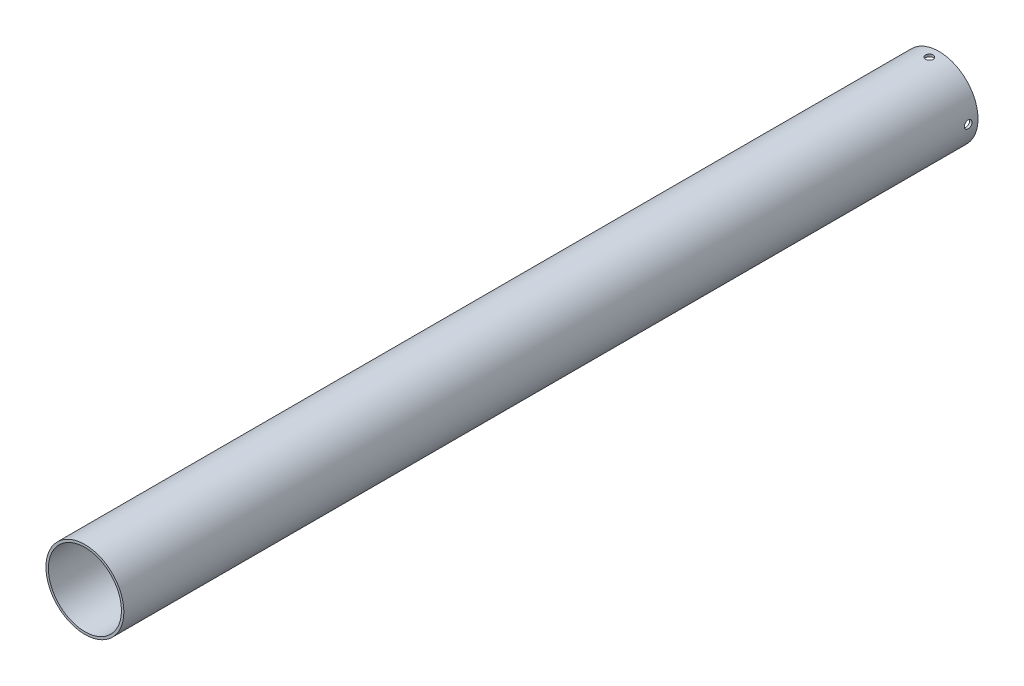
from build123d import *

# Parameters (mm, degrees)
SKETCH1_R               = 25.4
SKETCH1_R_2             = 23.8125
BOSS_EXTRUDE1_DEPTH     = 278.342506179
CUT_EXTRUDE1_DEPTH      = 281.650798584
CUT_EXTRUDE1_DEPTH_BACK = 281.650798584
SKETCH2_R               = 2.4892
CUT_EXTRUDE2_DEPTH      = 281.650798702
CUT_EXTRUDE2_DEPTH_BACK = 281.650798702
SKETCH3_R               = 2.4892


with BuildPart() as part:
    # Sketch1 → Boss-Extrude1 (new, symmetric)
    with BuildSketch(Plane.XY):
        Circle(SKETCH1_R)
        Circle(SKETCH1_R_2, mode=Mode.SUBTRACT)
    extrude(amount=BOSS_EXTRUDE1_DEPTH, both=True)

    # Sketch2 → Cut-Extrude1 (cut, two sides: drawn at the far end of the back side and taken through both)
    with BuildSketch(Plane(origin=(0, 0, 0), x_dir=(0, 0, -1), z_dir=(1, 0, 0)).offset(-CUT_EXTRUDE1_DEPTH_BACK)):
        with Locations((271.992506179, 0)):
            Circle(SKETCH2_R)
    extrude(amount=CUT_EXTRUDE1_DEPTH + CUT_EXTRUDE1_DEPTH_BACK, mode=Mode.SUBTRACT)

    # Sketch3 → Cut-Extrude2 (cut, two sides: drawn at the far end of the back side and taken through both)
    with BuildSketch(Plane(origin=(0, 0, 0), x_dir=(1, 0, 0), z_dir=(0, 1, 0)).offset(-CUT_EXTRUDE2_DEPTH_BACK)):
        with Locations(Location((0, 271.992506179, 0), (0, 0, 270))):
            Circle(SKETCH3_R)
    extrude(amount=CUT_EXTRUDE2_DEPTH + CUT_EXTRUDE2_DEPTH_BACK, mode=Mode.SUBTRACT)


solid = part.part
